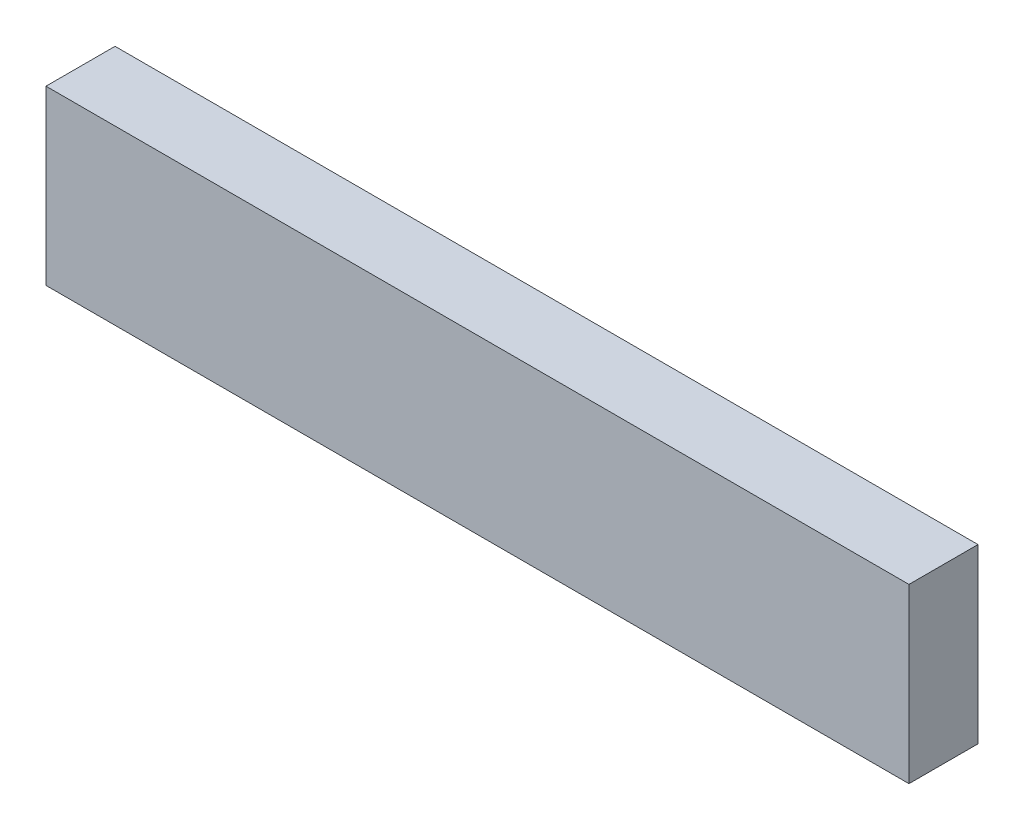
from build123d import *

# Parameters (mm, degrees)
SKETCH_1_W      = 250
SKETCH_1_H      = 50
EXTRUDE_1_DEPTH = 20


with BuildPart() as part:
    # 草图1 → 凸台-拉伸1 (new body)
    with BuildSketch(Plane.XY):
        Rectangle(SKETCH_1_W, SKETCH_1_H)
    extrude(amount=EXTRUDE_1_DEPTH)


solid = part.part
